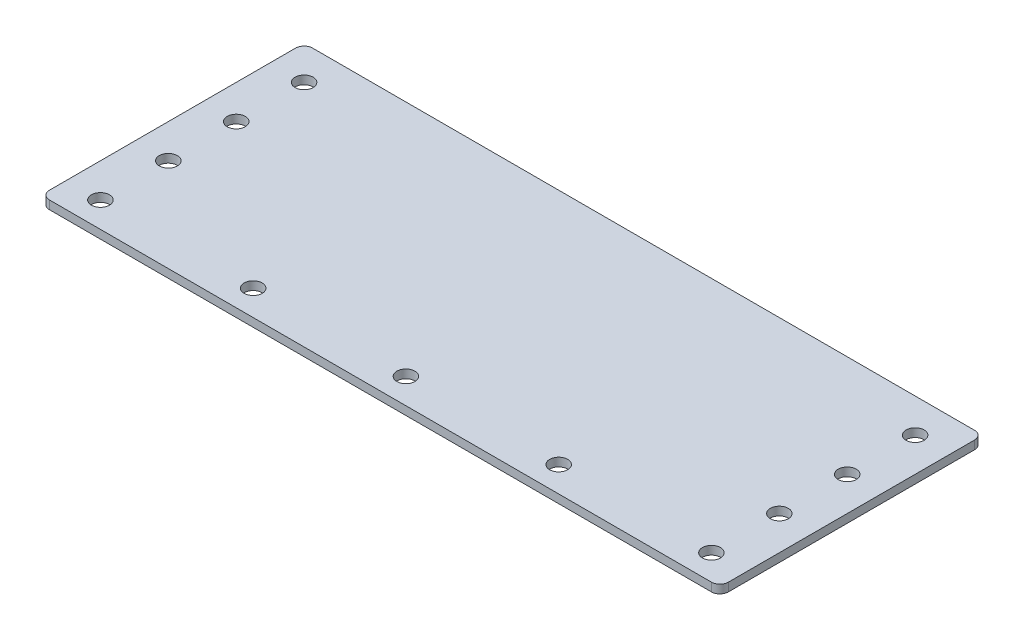
from build123d import *

# Parameters (mm, degrees)
SKETCH1_W                     = 254
SKETCH1_H                     = 98.425
SKETCH1_R                     = 6.35
BOSS_EXTRUDE1_DEPTH           = 3.175
TAP_DRILL_FOR_1_4_HELICOIL2_D = 6.7564
FILLET1_R                     = 3.175


with BuildPart() as part:
    # Sketch1 → Boss-Extrude1 (new body)
    # profile 1 of 2: a face of its own
    with BuildSketch(Plane(origin=(0, 0, 0), x_dir=(1, 0, 0), z_dir=(0, 1, 0))):
        Rectangle(SKETCH1_W, SKETCH1_H)
        with Locations((-114.3, 36.5125)):
            Circle(SKETCH1_R, mode=Mode.SUBTRACT)
    # profile 2 of 2: a face of its own
    with BuildSketch(Plane(origin=(0, 0, 0), x_dir=(1, 0, 0), z_dir=(0, 1, 0))):
        with Locations((-114.3, 36.5125)):
            Circle(SKETCH1_R)
    extrude(amount=BOSS_EXTRUDE1_DEPTH)

    # Tap Drill for 1/4 Helicoil2 (through all)
    with Locations(Plane(origin=(0, 0, 0), x_dir=(-1, 0, 0), z_dir=(0, -1, 0))):
        with Locations((-114.3, 36.5125), (-114.3, 11.1125), (-114.3, -14.2875), (-57.15, -39.6875), (0, -39.6875), (57.15, -39.6875), (114.3, -14.2875), (114.3, 11.1125), (114.3, 36.5125), (114.3, -39.6875), (-114.3, -39.6875)):
            Hole(TAP_DRILL_FOR_1_4_HELICOIL2_D / 2)

    # Fillet1
    fillet1_edges = [part.edges().sort_by_distance(p)[0] for p in [
        (-127, 1.5875, 49.2125),
        (-127, 1.5875, -49.2125),
        (127, 1.5875, -49.2125),
        (127, 1.5875, 49.2125),
    ]]
    fillet(fillet1_edges, radius=FILLET1_R)


solid = part.part
